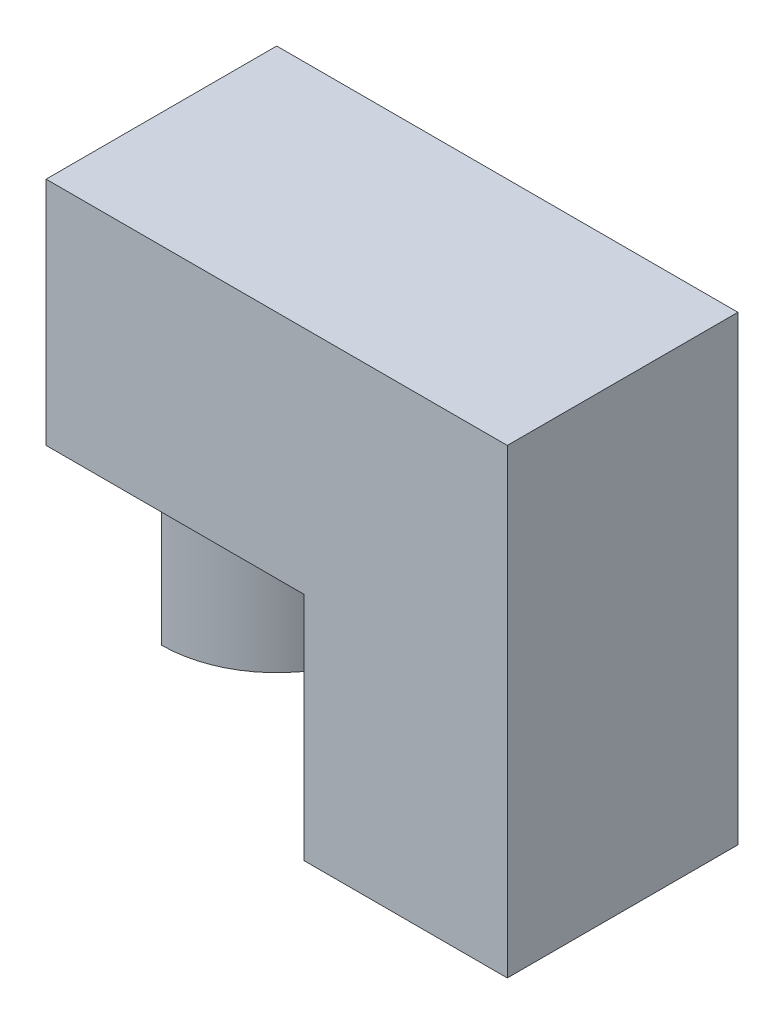
from build123d import *

# Parameters (mm, degrees)
SKETCH_1_W    = 20
SKETCH_1_H    = 20
BASEBOX_DEPTH = 10
SKETCH_2_W    = 10
SKETCH_2_H    = 10


with BuildPart() as part:
    # 草图1 → BaseBox (new body)
    with BuildSketch(Plane.XY):
        with Locations((10, 10)):
            Rectangle(SKETCH_1_W, SKETCH_1_H)
    extrude(amount=BASEBOX_DEPTH)

    # 草图2 → RevolveCut360 (revolve, cut)
    with BuildSketch(Plane.XY):
        with Locations((10, 5)):
            Rectangle(SKETCH_2_W, SKETCH_2_H)
    revolve(axis=Axis((0, 0, 0), (0, 1, 0)), mode=Mode.SUBTRACT)


solid = part.part
